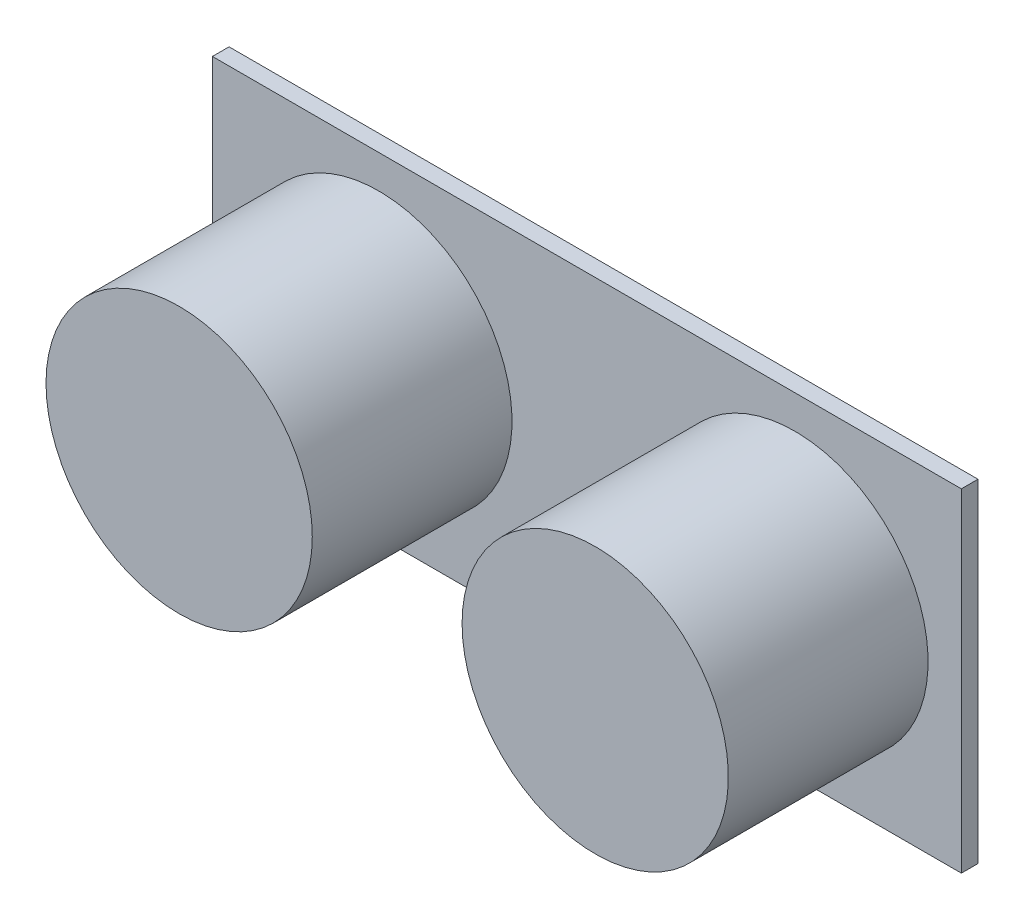
from build123d import *

# Parameters (mm, degrees)
SKETCH1_W           = 45
SKETCH1_H           = 20
BOSS_EXTRUDE1_DEPTH = 1
SKETCH2_R           = 8
BOSS_EXTRUDE2_DEPTH = 12


with BuildPart() as part:
    # Sketch1 → Boss-Extrude1 (new body)
    with BuildSketch(Plane.XY):
        Rectangle(SKETCH1_W, SKETCH1_H)
    extrude(amount=BOSS_EXTRUDE1_DEPTH)

    # Sketch2 → Boss-Extrude2 (add)
    with BuildSketch(Plane.XY.offset(1)):
        with Locations(Location((-12.5, 0, 0), (0, 0, 180))):
            Circle(SKETCH2_R)
    boss_extrude2 = extrude(amount=BOSS_EXTRUDE2_DEPTH)

    # Mirror1: Boss-Extrude2 across plane
    add(boss_extrude2.mirror(Plane(origin=(0, 0, 0), x_dir=(0, 0, 1), z_dir=(1, 0, 0))))


solid = part.part
